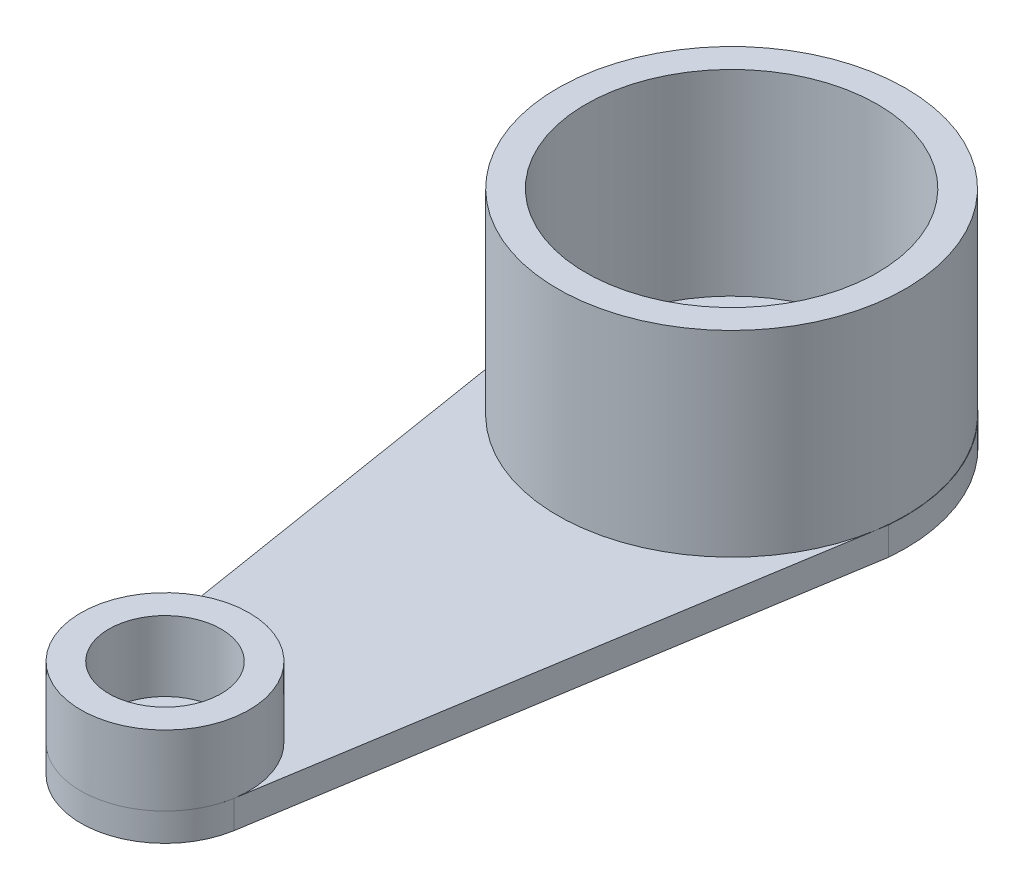
from build123d import *

# Parameters (mm, degrees)
BOSS_EXTRUDE1_DEPTH = 1
BOSS_EXTRUDE5_START = 1
SKETCH1_5_R         = 3
SKETCH1_5_R_2       = 2
BOSS_EXTRUDE5_DEPTH = 2.5
BOSS_EXTRUDE4_START = 1
SKETCH1_4_R         = 6.2
SKETCH1_4_R_2       = 5.2
BOSS_EXTRUDE4_DEPTH = 7
SKETCH1_8_R         = 0.85
CUT_EXTRUDE7_DEPTH  = 10


with BuildPart() as part:
    # Sketch1 → Boss-Extrude1 (new body)
    with BuildSketch(Plane(origin=(0, 0, 0), x_dir=(1, 0, 0), z_dir=(0, 1, 0))):
        with BuildLine():
            Line((-6.18471188, 6.920224585), (-2.957423424, -13.194782769))
            ThreePointArc((-2.957423424, -13.194782769), (0, -15.690424696), (2.957423424, -13.194782769))
            Line((2.957423424, -13.194782769), (6.18471188, 6.920224585))
            ThreePointArc((6.18471188, 6.920224585), (0, 13.722464008), (-6.18471188, 6.920224585))
        make_face()
    extrude(amount=BOSS_EXTRUDE1_DEPTH)

    # Sketch1<5> → Boss-Extrude5 (add)
    with BuildSketch(Plane(origin=(0, 0, 0), x_dir=(1, 0, 0), z_dir=(0, 1, 0)).offset(BOSS_EXTRUDE5_START)):
        with Locations(Location((0, -12.690278367, 0), (0, 0, 90))):
            Circle(SKETCH1_5_R)
        with Locations(Location((0, -12.690278367, 0), (0, 0, 90))):
            Circle(SKETCH1_5_R_2, mode=Mode.SUBTRACT)
    extrude(amount=BOSS_EXTRUDE5_DEPTH)

    # Sketch1<4> → Boss-Extrude4 (add)
    with BuildSketch(Plane(origin=(0, 0, 0), x_dir=(1, 0, 0), z_dir=(0, 1, 0)).offset(BOSS_EXTRUDE4_START)):
        with Locations(Location((0, 7.509721633, 0), (0, 0, 90))):
            Circle(SKETCH1_4_R)
        with Locations(Location((0, 7.509721633, 0), (0, 0, 90))):
            Circle(SKETCH1_4_R_2, mode=Mode.SUBTRACT)
    extrude(amount=BOSS_EXTRUDE4_DEPTH)

    # Sketch1<8> → Cut-Extrude7 (cut)
    with BuildSketch(Plane(origin=(0, 0, 0), x_dir=(1, 0, 0), z_dir=(0, 1, 0))):
        with Locations(Location((0, 7.509721633, 0), (0, 0, 90))):
            Circle(SKETCH1_8_R)
        with Locations(Location((0, -12.690278367, 0), (0, 0, 90))):
            Circle(SKETCH1_8_R)
    extrude(amount=CUT_EXTRUDE7_DEPTH, mode=Mode.SUBTRACT)


solid = part.part
